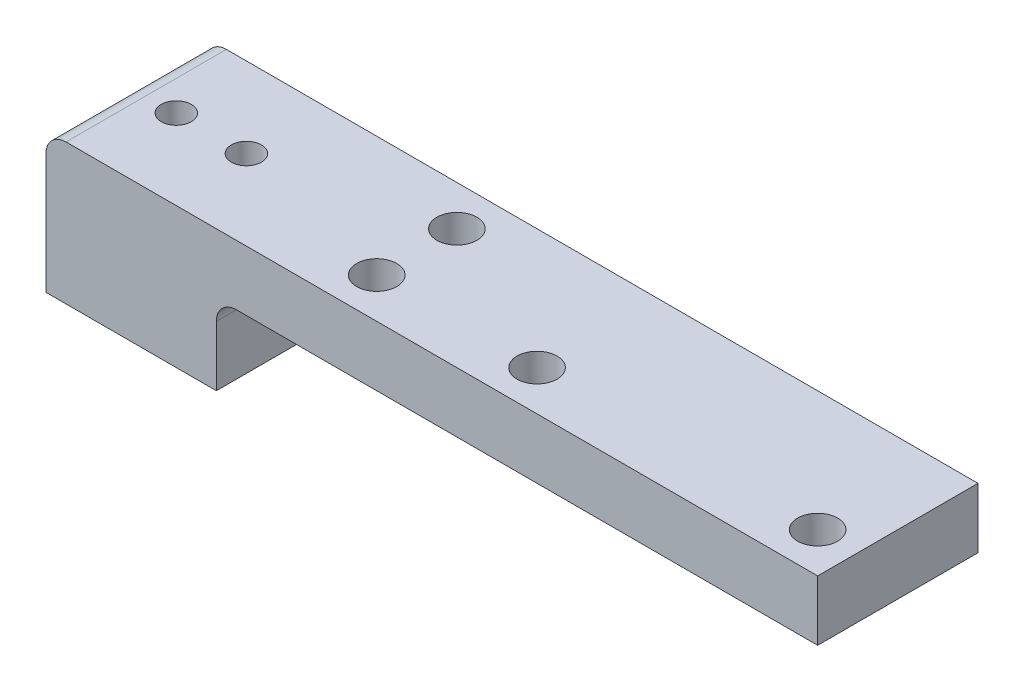
from build123d import *

# Parameters (mm, degrees)
SKETCH1_W           = 17
SKETCH1_H           = 16
SKETCH1_R           = 1.5
BOSS_EXTRUDE1_DEPTH = 14
SKETCH3_W           = 16
SKETCH3_H           = 6
BOSS_EXTRUDE2_DEPTH = 60
SKETCH4_R           = 2
CUT_EXTRUDE1_DEPTH  = 71.372224634
FILLET1_R           = 2
FILLET2_R           = 2


with BuildPart() as part:
    # Sketch1 → Boss-Extrude1 (new body)
    with BuildSketch(Plane(origin=(0, 0, 0), x_dir=(1, 0, 0), z_dir=(0, 1, 0))):
        Rectangle(SKETCH1_W, SKETCH1_H)
        with Locations(Location((-3.5, 0, 0), (0, 0, 270))):
            Circle(SKETCH1_R, mode=Mode.SUBTRACT)
        with Locations(Location((3.5, 0, 0), (0, 0, 270))):
            Circle(SKETCH1_R, mode=Mode.SUBTRACT)
    extrude(amount=BOSS_EXTRUDE1_DEPTH)

    # Sketch3 → Boss-Extrude2 (add)
    with BuildSketch(Plane(origin=(8.5, 0, 0), x_dir=(0, 0, -1), z_dir=(1, 0, 0))):
        with Locations((0, 11)):
            Rectangle(SKETCH3_W, SKETCH3_H)
    extrude(amount=BOSS_EXTRUDE2_DEPTH)

    # Sketch4 → Cut-Extrude1 (cut, through all)
    with BuildSketch(Plane(origin=(0, 14, 0), x_dir=(1, 0, 0), z_dir=(0, 1, 0))):
        with Locations(Location((36.5, -4, 0), (0, 0, 270))):
            Circle(SKETCH4_R)
        with Locations(Location((64.5, -4, 0), (0, 0, 270))):
            Circle(SKETCH4_R)
        with Locations(Location((20.5, 4, 0), (0, 0, 270))):
            Circle(SKETCH4_R)
        with Locations(Location((20.5, -4, 0), (0, 0, 270))):
            Circle(SKETCH4_R)
    extrude(amount=-CUT_EXTRUDE1_DEPTH, mode=Mode.SUBTRACT)

    # Fillet1
    fillet1_edges = [part.edges().sort_by_distance(p)[0] for p in [
        (8.5, 8, 0),
    ]]
    fillet(fillet1_edges, radius=FILLET1_R)

    # Fillet2
    fillet2_edges = [part.edges().sort_by_distance(p)[0] for p in [
        (-8.5, 14, 0),
    ]]
    fillet(fillet2_edges, radius=FILLET2_R)


solid = part.part
